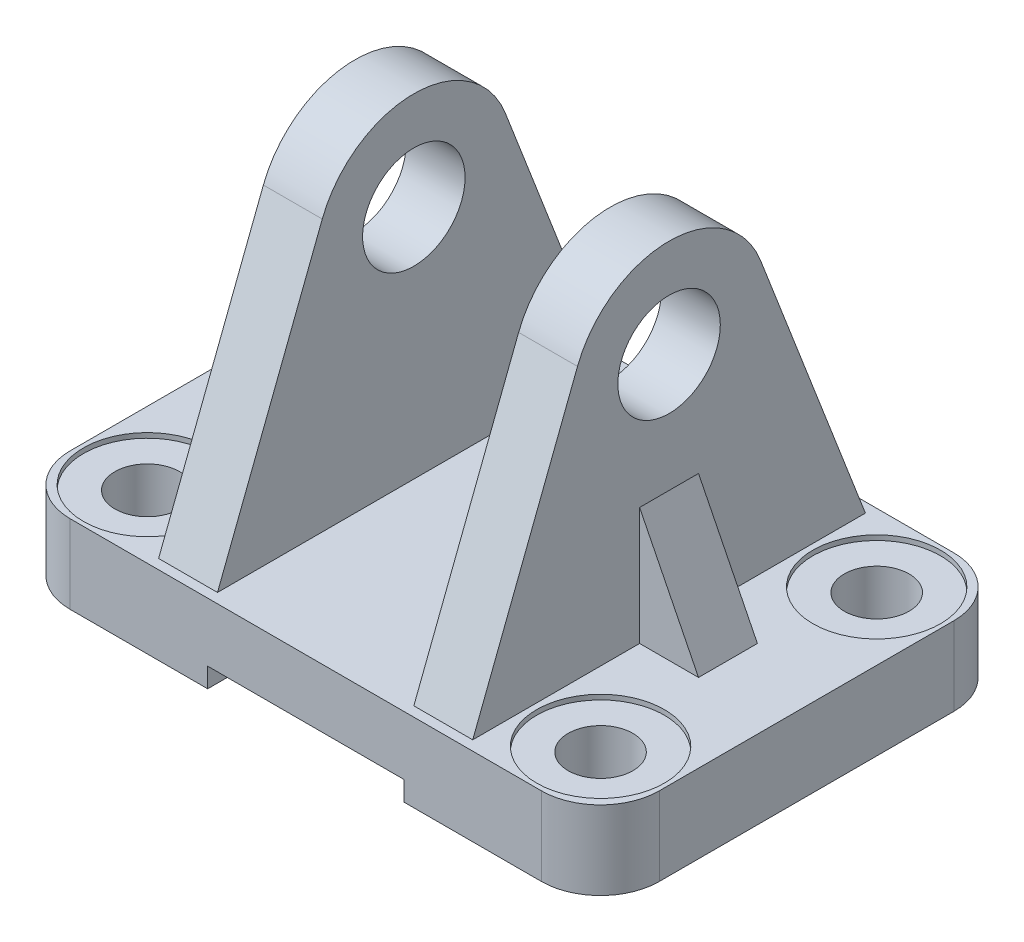
from build123d import *

# Parameters (mm, degrees)
EXTRUDE_1_DEPTH             = 21
EXTRUDE_START               = 4
SKETCH_2_R                  = 5.220451321
EXTRUDE_3_DEPTH             = 6
RIB_1_REACH                 = 57.723
SKETCH_6_WALL_W             = 126.861461592
SKETCH_6_WALL_H             = 6
FILLET_1_R                  = 6
FILLET_2_R                  = 6
HOLE_WIZARD_C_3_D           = 6.6
HOLE_WIZARD_C_3_CBORE_D     = 13
HOLE_WIZARD_C_3_CBORE_DEPTH = 0.5
FILLET_3_R                  = 6
FILLET_4_R                  = 6
MIRROR_6_COPY_1_D           = 6.6
MIRROR_6_COPY_1_CBORE_D     = 13
MIRROR_6_COPY_1_CBORE_DEPTH = 0.5
MIRROR_6_COPY_2_D           = 6.6
MIRROR_6_COPY_2_CBORE_D     = 13
MIRROR_6_COPY_2_CBORE_DEPTH = 0.5


with BuildPart() as part:
    # 草图1 → 凸台-拉伸1 (new, symmetric)
    with BuildSketch(Plane.XY):
        Polygon((-10, 2), (10, 2), (10, 0), (30, 0), (30, 8), (-30, 8), (-30, 0), (-10, 0), align=None)
    extrude(amount=EXTRUDE_1_DEPTH, both=True)

    # 草图2 → 凸台-拉伸3 (add)
    with BuildSketch(Plane(origin=(6, 0, 0), x_dir=(0, 0, -1), z_dir=(1, 0, 0)).offset(EXTRUDE_START)):
        with BuildLine():
            Line((-20, 8), (20, 8))
            Line((20, 8), (9.327204223, 35.606003519))
            ThreePointArc((9.327204223, 35.606003519), (0, 42), (-9.327204223, 35.606003519))
            Line((-9.327204223, 35.606003519), (-20, 8))
        make_face()
        with Locations((0, 32)):
            Circle(SKETCH_2_R, mode=Mode.SUBTRACT)
    extrude_3 = extrude(amount=EXTRUDE_3_DEPTH)

    # 草图6 wall → 筋1 (add, up to next)
    with BuildSketch(Plane(origin=(19, 14, 0), x_dir=(0.4472135955, -0.894427191, 0), z_dir=(0.894427191, 0.4472135955, 0)), mode=Mode.PRIVATE) as rib_1_sk1:
        Rectangle(SKETCH_6_WALL_W, SKETCH_6_WALL_H)
    rib_1_tool1 = extrude(rib_1_sk1.sketch, amount=-RIB_1_REACH, mode=Mode.PRIVATE) - part.part
    rib_1 = rib_1_tool1.solids().sort_by_distance((19, 14, 0))[0]
    add(rib_1)

    # 圆角1
    fillet_1_edges = [part.edges().sort_by_distance(p)[0] for p in [
        (30, 4, 21),
    ]]
    fillet(fillet_1_edges, radius=FILLET_1_R)

    # 圆角2
    fillet_2_edges = [part.edges().sort_by_distance(p)[0] for p in [
        (30, 4, -21),
    ]]
    fillet(fillet_2_edges, radius=FILLET_2_R)

    # 打孔尺寸(%根据六角头螺)栓 C 级的类型3 (through all)
    with Locations(Plane(origin=(0, 8, 0), x_dir=(1, 0, 0), z_dir=(0, 1, 0))):
        with Locations((23.086377714, -14.06523012)):
            hole_wizard_c_3 = CounterBoreHole(HOLE_WIZARD_C_3_D / 2, HOLE_WIZARD_C_3_CBORE_D / 2, HOLE_WIZARD_C_3_CBORE_DEPTH)

    # 镜向1: 凸台-拉伸3, 筋1, 打孔尺寸(%根据六角头螺)栓 C 级的类型3 across plane
    add(extrude_3.mirror(Plane(origin=(0, 0, 0), x_dir=(0, 0, 1), z_dir=(1, 0, 0))))
    add(rib_1.mirror(Plane(origin=(0, 0, 0), x_dir=(0, 0, 1), z_dir=(1, 0, 0))))
    add(hole_wizard_c_3.mirror(Plane(origin=(0, 0, 0), x_dir=(0, 0, 1), z_dir=(1, 0, 0))), mode=Mode.SUBTRACT)

    # 圆角3
    fillet_3_edges = [part.edges().sort_by_distance(p)[0] for p in [
        (-30, 4, 21),
    ]]
    fillet(fillet_3_edges, radius=FILLET_3_R)

    # 圆角4
    fillet_4_edges = [part.edges().sort_by_distance(p)[0] for p in [
        (-30, 4, -21),
    ]]
    fillet(fillet_4_edges, radius=FILLET_4_R)

    # 镜向2: 打孔尺寸(%根据六角头螺)栓 C 级的类型3 across plane
    add(hole_wizard_c_3.mirror(Plane.XY), mode=Mode.SUBTRACT)

    # 镜向6 copy 1 (through all)
    with Locations(Plane(origin=(0, 8, 0), x_dir=(-1, 0, 0), z_dir=(0, 1, 0))):
        with Locations((23.086377714, -14.06523012)):
            CounterBoreHole(MIRROR_6_COPY_1_D / 2, MIRROR_6_COPY_1_CBORE_D / 2, MIRROR_6_COPY_1_CBORE_DEPTH)

    # 镜向6 copy 2 (through all)
    with Locations(Plane(origin=(0, 8, 0), x_dir=(-1, 0, 0), z_dir=(0, 1, 0))):
        with Locations((23.086377714, 14.06523012)):
            CounterBoreHole(MIRROR_6_COPY_2_D / 2, MIRROR_6_COPY_2_CBORE_D / 2, MIRROR_6_COPY_2_CBORE_DEPTH)


solid = part.part
